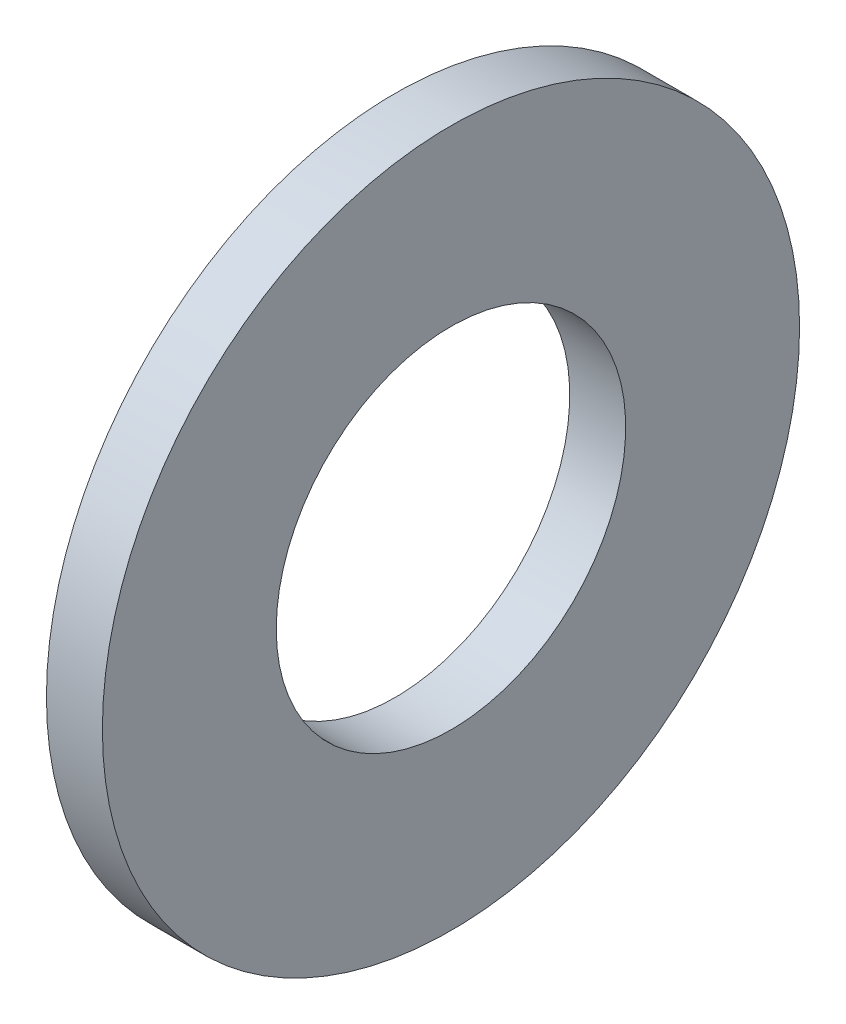
from build123d import *

# Parameters (mm, degrees)
SKETCH2_W = 1.651
SKETCH2_H = 5.1308


with BuildPart() as part:
    # Sketch2 → Revolve1 (revolve)
    with BuildSketch(Plane.XY, mode=Mode.PRIVATE) as revolve1_sk:
        with Locations((0.8255, 7.7216)):
            Rectangle(SKETCH2_W, SKETCH2_H)
    revolve(revolve1_sk.sketch.rotate(Axis((0, 0, 0), (1, 0, 0)), 90), axis=Axis((0, 0, 0), (1, 0, 0)))


solid = part.part
